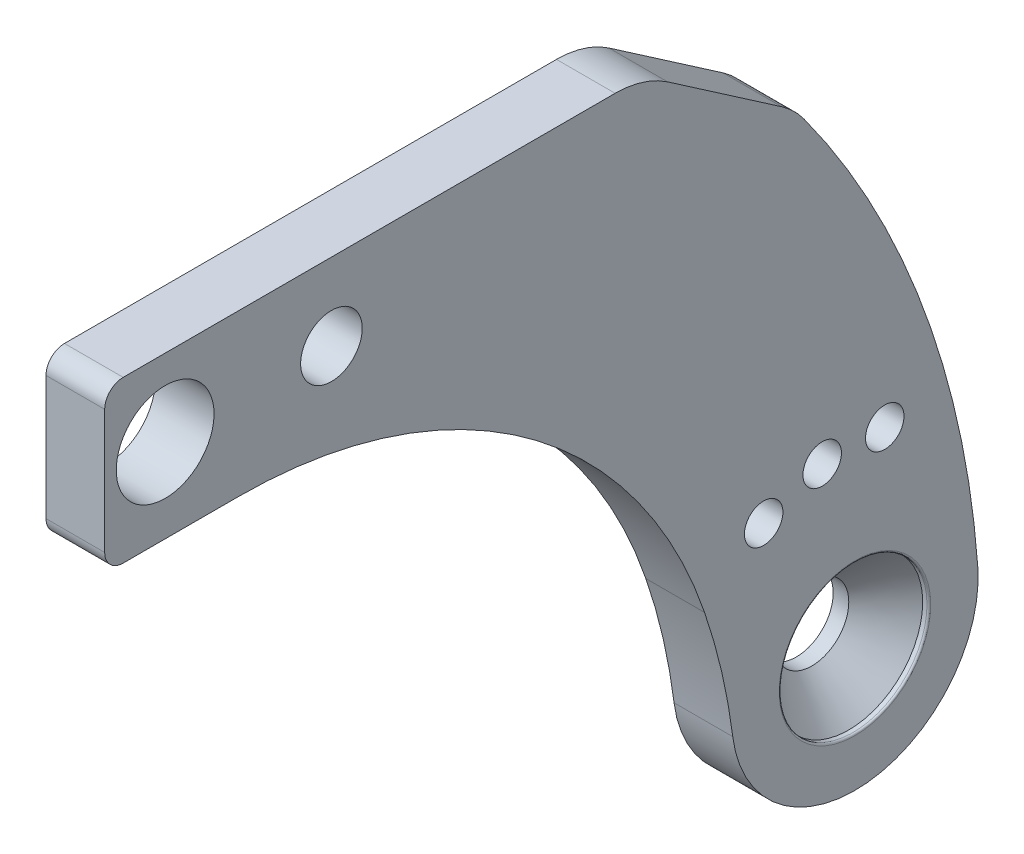
from build123d import *

# Parameters (mm, degrees)
CROQUIS13_R                = 5
CROQUIS13_R_2              = 6
SALIENTE_EXTRUIR1_DEPTH    = 4.765
REDONDEO2_R                = 0.3
REDONDEO3_R                = 80
REDONDEO4_R                = 15
CORTAR_EXTRUIR2_REACH      = 170.937
CROQUIS18_R                = 3.125
CORTAR_EXTRUIR3_DEPTH      = 169.735607463
CORTAR_EXTRUIR3_DEPTH_BACK = 169.735607463
REDONDEO5_R                = 3
CORTAR_EXTRUIR4_DEPTH      = 169.735607463
CORTAR_EXTRUIR4_DEPTH_BACK = 169.735607463
CROQUIS21_R                = 7.94


with BuildPart() as part:
    # Croquis13 → Saliente-Extruir1 (new, symmetric)
    with BuildSketch(Plane(origin=(0, 0, 0), x_dir=(0, 0, -1), z_dir=(1, 0, 0))):
        with BuildLine():
            Line((102.163414857, -4.327209349), (81.574356475, 9.853435029))
            ThreePointArc((81.574356475, 9.853435029), (77.521218134, 11.823084958), (73.065969849, 12.5))
            Line((73.065969849, 12.5), (-16.81645687, 12.5))
            ThreePointArc((-16.81645687, 12.5), (-20.351990776, 11.035533906), (-21.81645687, 7.5))
            Line((-21.81645687, 7.5), (-21.81645687, -8.626101457))
            ThreePointArc((-21.81645687, -8.626101457), (-20.351990776, -12.161635363), (-16.81645687, -13.626101457))
            Line((-16.81645687, -13.626101457), (43.18354313, -13.626101457))
            ThreePointArc((43.18354313, -13.626101457), (76.306099966, -44.847644025), (92.158871945, -87.515877082))
            ThreePointArc((92.158871945, -87.515877082), (113.995550437, -104.900195438), (131.945619804, -83.526144302))
            ThreePointArc((131.945619804, -83.526144302), (122.754645176, -41.783183661), (102.163414857, -4.327209349))
        make_face()
        with Locations((27, 0)):
            Circle(CROQUIS13_R, mode=Mode.SUBTRACT)
        Circle(CROQUIS13_R, mode=Mode.SUBTRACT)
        with Locations((112, -85)):
            Circle(CROQUIS13_R_2, mode=Mode.SUBTRACT)
    extrude(amount=SALIENTE_EXTRUIR1_DEPTH, both=True)

    # Croquis15 → Cortar-Revolución2 (revolve, cut)
    with BuildSketch(Plane(origin=(0, -85, 0), x_dir=(1, 0, 0), z_dir=(0, 1, 0)), mode=Mode.PRIVATE) as cortar_revoluci_n2_sk:
        Polygon((4.765, 106.01), (4.765, 100), (3.765, 100), (-2.245, 106.01), align=None)
    revolve(cortar_revoluci_n2_sk.sketch.rotate(Axis((4.765, -85, -112), (-1, 0, 0)), 180), axis=Axis((4.765, -85, -112), (-1, 0, 0)), mode=Mode.SUBTRACT)

    # Redondeo2
    redondeo2_edges = [part.edges().sort_by_distance(p)[0] for p in [
        (4.765, -85, -100),
    ]]
    fillet(redondeo2_edges, radius=REDONDEO2_R)

    # Redondeo3
    redondeo3_edges = [part.edges().sort_by_distance(p)[0] for p in [
        (0, -13.626101457, -43.18354313),
    ]]
    fillet(redondeo3_edges, radius=REDONDEO3_R)

    # Redondeo4
    redondeo4_edges = [part.edges().sort_by_distance(p)[0] for p in [
        (0, -4.327209349, -102.163414857),
    ]]
    fillet(redondeo4_edges, radius=REDONDEO4_R)

    # Croquis18 → Cortar-Extruir2 (cut, up to next)
    with BuildSketch(Plane.ZY.offset(4.765), mode=Mode.PRIVATE) as cortar_extruir2_sk1:
        with Locations((-97.175215853, -60)):
            Circle(CROQUIS18_R)
    cortar_extruir2_tool1 = extrude(cortar_extruir2_sk1.sketch, amount=-CORTAR_EXTRUIR2_REACH, mode=Mode.PRIVATE) & part.part
    # Croquis18 → Cortar-Extruir2 (cut, up to next)
    with BuildSketch(Plane.ZY.offset(4.765), mode=Mode.PRIVATE) as cortar_extruir2_sk2:
        with Locations((-116.837549653, -56.340405824)):
            Circle(CROQUIS18_R)
    cortar_extruir2_tool2 = extrude(cortar_extruir2_sk2.sketch, amount=-CORTAR_EXTRUIR2_REACH, mode=Mode.PRIVATE) & part.part
    # Croquis18 → Cortar-Extruir2 (cut, up to next)
    with BuildSketch(Plane.ZY.offset(4.765), mode=Mode.PRIVATE) as cortar_extruir2_sk3:
        with Locations((-106.681694763, -56.425713405)):
            Circle(CROQUIS18_R)
    cortar_extruir2_tool3 = extrude(cortar_extruir2_sk3.sketch, amount=-CORTAR_EXTRUIR2_REACH, mode=Mode.PRIVATE) & part.part
    add(cortar_extruir2_tool1.solids().sort_by_distance((-4.765, -60, -97.175216))[0], mode=Mode.SUBTRACT)
    add(cortar_extruir2_tool2.solids().sort_by_distance((-4.765, -56.340406, -116.83755))[0], mode=Mode.SUBTRACT)
    add(cortar_extruir2_tool3.solids().sort_by_distance((-4.765, -56.425713, -106.681695))[0], mode=Mode.SUBTRACT)

    # Croquis20 → Cortar-Extruir3 (cut, two sides: drawn at the far end of the back side and taken through both)
    with BuildSketch(Plane(origin=(0, 0, 0), x_dir=(0, 0, -1), z_dir=(1, 0, 0)).offset(-CORTAR_EXTRUIR3_DEPTH_BACK)):
        with BuildLine():
            Line((-21.81645687, 7.5), (-21.81645687, -8.626101457))
            ThreePointArc((-21.81645687, -8.626101457), (-20.351990776, -12.161635363), (-16.81645687, -13.626101457))
            Line((-16.81645687, -13.626101457), (-9.81645687, -13.626101457))
            Line((-9.81645687, -13.626101457), (-9.81645687, 12.5))
            Line((-9.81645687, 12.5), (-16.81645687, 12.5))
            ThreePointArc((-16.81645687, 12.5), (-20.351990776, 11.035533906), (-21.81645687, 7.5))
        make_face()
    extrude(amount=CORTAR_EXTRUIR3_DEPTH + CORTAR_EXTRUIR3_DEPTH_BACK, mode=Mode.SUBTRACT)

    # Redondeo5
    redondeo5_edges = [part.edges().sort_by_distance(p)[0] for p in [
        (0, 12.5, 9.81645687),
        (0, -13.626101457, 9.81645687),
    ]]
    fillet(redondeo5_edges, radius=REDONDEO5_R)

    # Croquis21 → Cortar-Extruir4 (cut, two sides: drawn at the far end of the back side and taken through both)
    with BuildSketch(Plane(origin=(0, 0, 0), x_dir=(0, 0, -1), z_dir=(1, 0, 0)).offset(-CORTAR_EXTRUIR4_DEPTH_BACK)):
        Circle(CROQUIS21_R)
    extrude(amount=CORTAR_EXTRUIR4_DEPTH + CORTAR_EXTRUIR4_DEPTH_BACK, mode=Mode.SUBTRACT)


solid = part.part
